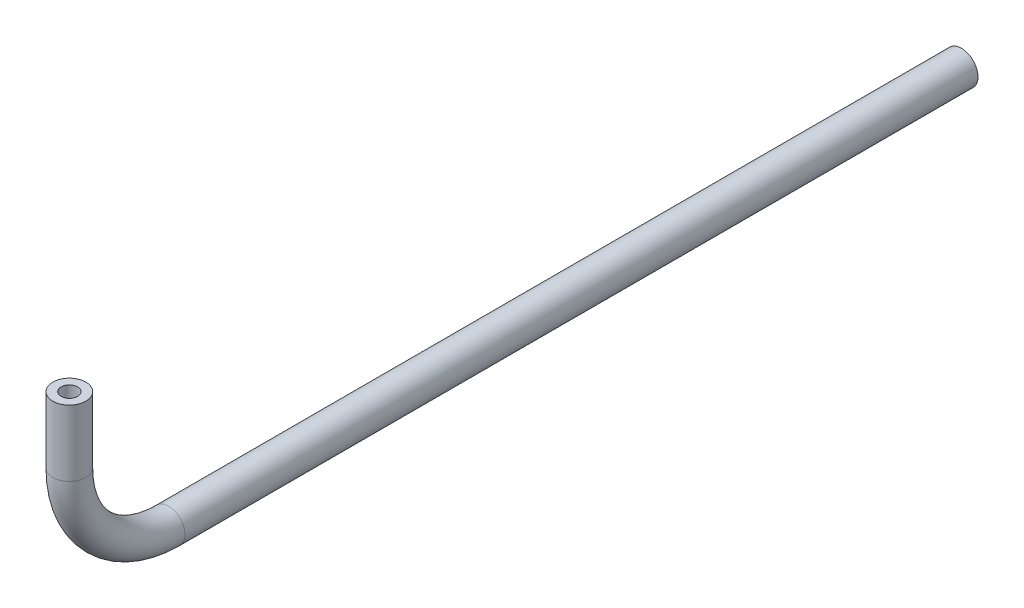
from build123d import *

# Parameters (mm, degrees)
SWEEP1_PROFILE_R     = 6.35
CUT_SWEEP1_PROFILE_R = 3.175


with BuildPart() as part:
    # Sweep1: sweep along a curve in space
    with BuildLine() as sweep1_path:
        Line((0, 50.8, 340.36), (0, 76.2, 340.36))
        ThreePointArc((0, 12.7, 302.26), (0, 23.859231637, 329.200768363), (0, 50.8, 340.36))
        Line((0, 12.7, 302.26), (0, 12.7, -2.54))
    # Sweep1 profile (on start of the path) → Sweep1 (sweep)
    with BuildSketch(Plane(origin=(0, 12.7, -2.54), x_dir=(1, 0, 0), z_dir=(0, 0, 1))):
        Circle(SWEEP1_PROFILE_R)
    sweep(path=sweep1_path.line)

    # Cut-Sweep1: sweep along a curve in space
    with BuildLine() as cut_sweep1_path:
        Line((0, 50.8, 340.36), (0, 76.2, 340.36))
        ThreePointArc((0, 12.7, 302.26), (0, 23.859231637, 329.200768363), (0, 50.8, 340.36))
        Line((0, 12.7, 302.26), (0, 12.7, -2.54))
    # Cut-Sweep1 profile (on start of the path) → Cut-Sweep1 (sweep, cut)
    with BuildSketch(Plane(origin=(0, 12.7, -2.54), x_dir=(1, 0, 0), z_dir=(0, 0, 1))):
        Circle(CUT_SWEEP1_PROFILE_R)
    sweep(path=cut_sweep1_path.line, mode=Mode.SUBTRACT)


solid = part.part
